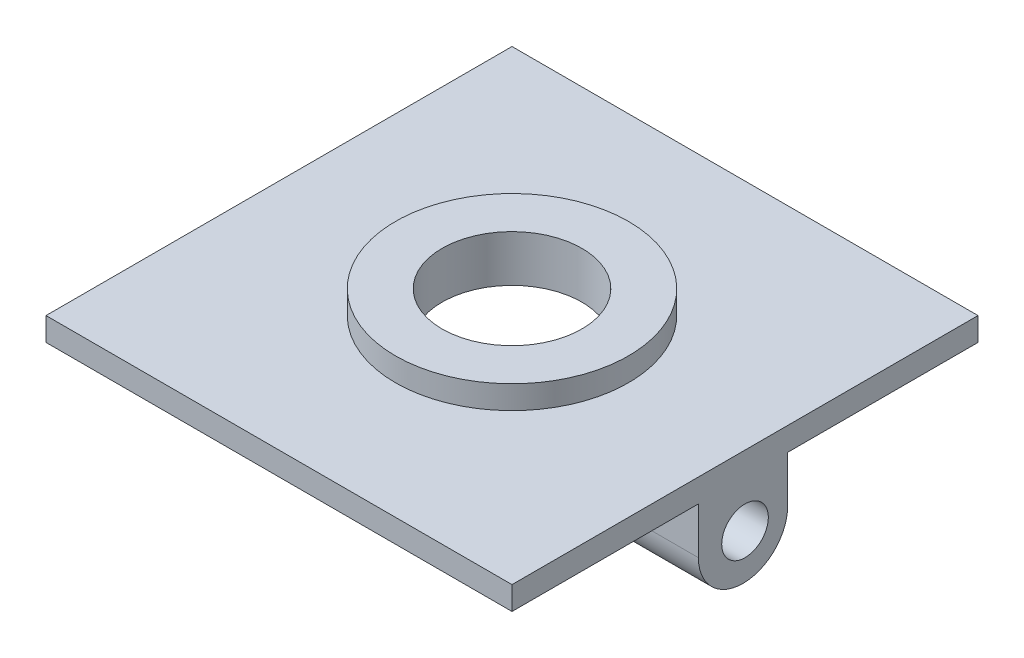
from build123d import *

# Parameters (mm, degrees)
SKETCH_1_W          = 100
SKETCH_1_H          = 100
EXTRUDE_1_DEPTH     = 5
SKETCH_2_R          = 25
EXTRUDE_2_DEPTH     = 5
SKETCH_3_R          = 15
CUT_EXTRUDE_1_DEPTH = 10
EXTRUDE_3_DEPTH     = 20
EXTRUDE_4_DEPTH     = 20
SKETCH_6_R          = 5
CUT_EXTRUDE_2_DEPTH = 100


with BuildPart() as part:
    # 草图1 → 凸台-拉伸1 (new body)
    with BuildSketch(Plane(origin=(0, 0, 0), x_dir=(1, 0, 0), z_dir=(0, 1, 0))):
        with Locations((50, -50)):
            Rectangle(SKETCH_1_W, SKETCH_1_H)
    extrude(amount=EXTRUDE_1_DEPTH)

    # 草图2 → 凸台-拉伸2 (add)
    with BuildSketch(Plane(origin=(0, 5, 0), x_dir=(1, 0, 0), z_dir=(0, 1, 0))):
        with Locations(Location((50, -50, 0), (0, 0, 270))):
            Circle(SKETCH_2_R)
    extrude(amount=EXTRUDE_2_DEPTH)

    # 草图3 → 切除-拉伸1 (cut)
    with BuildSketch(Plane(origin=(0, 10, 0), x_dir=(1, 0, 0), z_dir=(0, 1, 0))):
        with Locations(Location((50, -50, 0), (0, 0, 270))):
            Circle(SKETCH_3_R)
    extrude(amount=-CUT_EXTRUDE_1_DEPTH, mode=Mode.SUBTRACT)

    # 草图4 → 凸台-拉伸3 (add)
    with BuildSketch(Plane(origin=(100, 0, 0), x_dir=(0, 0, -1), z_dir=(1, 0, 0))):
        with BuildLine():
            Line((-60, 0), (-40.851510599, 0))
            Line((-40.851510599, 0), (-40.851510599, -10))
            ThreePointArc((-40.851510599, -10), (-50.4257553, -19.5742447), (-60, -10))
            Line((-60, -10), (-60, 0))
        make_face()
    extrude(amount=-EXTRUDE_3_DEPTH)

    # 草图5 → 凸台-拉伸4 (add)
    with BuildSketch(Plane.ZY):
        with BuildLine():
            Line((40, 0), (60, 0))
            Line((60, 0), (60, -10))
            ThreePointArc((60, -10), (50, -20), (40, -10))
            Line((40, -10), (40, 0))
        make_face()
    extrude(amount=-EXTRUDE_4_DEPTH)

    # 草图6 → 切除-拉伸2 (cut)
    with BuildSketch(Plane.ZY):
        with Locations((50, -10)):
            Circle(SKETCH_6_R)
    extrude(amount=-CUT_EXTRUDE_2_DEPTH, mode=Mode.SUBTRACT)


solid = part.part
